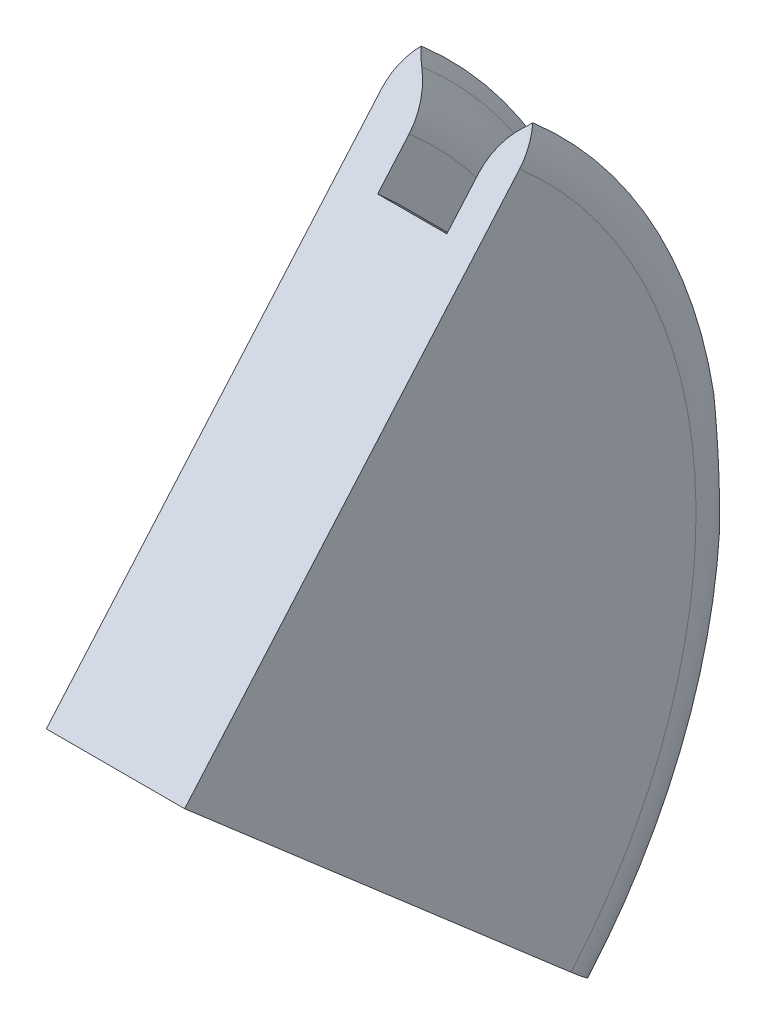
from build123d import *

# Parameters (mm, degrees)
CUT_EXTRUDE1_DEPTH      = 12.33524834
CUT_EXTRUDE1_DEPTH_BACK = 12.33524834
SKETCH3_OUTSIDE_W       = 22.502
SKETCH3_OUTSIDE_H       = 22.502


with BuildPart() as part:
    # Sketch2 → Revolve1 (revolve)
    with BuildSketch(Plane(origin=(0, 0, 0), x_dir=(1, 0, 0), z_dir=(0, 1, 0)), mode=Mode.PRIVATE) as revolve1_sk:
        with BuildLine():
            Line((-1, 0), (1, 0))
            Line((1, 0), (1, 5.5))
            Line((1, 5.5), (1, 7.395254938))
            ThreePointArc((1, 7.395254938), (0.968908672, 7.642673583), (0.877568029, 7.874707079))
            add(Edge.make_bspline(
                [(0.820511391, 7.803982399), (0.850646042, 7.838050546), (0.877568029, 7.874707079)],
                knots=[2.4177114, 2.4177114, 2.4177114, 2.508439234, 2.508439234, 2.508439234], degree=2, weights=[1, 0.998971234, 1]))
            ThreePointArc((0.820511391, 7.803982399), (0.634382255, 7.495682579), (0.569535838, 7.14144004))
            Line((0.569535838, 7.14144004), (0.569535838, 6.447627469))
            Line((0.569535838, 6.447627469), (-0.430464162, 6.447627469))
            Line((-0.430464162, 6.447627469), (-0.430464162, 7.14144004))
            ThreePointArc((-0.430464162, 7.14144004), (-0.495310579, 7.495682579), (-0.681439715, 7.803982399))
            add(Edge.make_bspline(
                [(-0.80833384, 7.983979325), (-0.754845236, 7.886969591), (-0.681439715, 7.803982399)],
                knots=[0.503618874, 0.503618874, 0.503618874, 0.723881254, 0.723881254, 0.723881254], degree=2, weights=[1, 0.993941688, 1]))
            ThreePointArc((-0.80833384, 7.983979325), (-0.950876921, 7.704824123), (-1, 7.395254938))
            Line((-1, 7.395254938), (-1, 5.5))
            Line((-1, 5.5), (-1, 0))
        make_face()
    revolve(revolve1_sk.sketch.rotate(Axis((0, 0, 0), (1, 0, 0)), 180), axis=Axis((0, 0, 0), (1, 0, 0)))

    # Sketch3 outside → Cut-Extrude1 (cut, two sides: drawn at the far end of the back side and taken through both)
    with BuildSketch(Plane(origin=(0, 0, 0), x_dir=(0, 0, -1), z_dir=(1, 0, 0)).offset(-CUT_EXTRUDE1_DEPTH_BACK)):
        Rectangle(SKETCH3_OUTSIDE_W, SKETCH3_OUTSIDE_H)
        Polygon((0, 0), (7.412882699, 8.555619308), (8.184858407, -7.091642708), align=None, mode=Mode.SUBTRACT)
    extrude(amount=CUT_EXTRUDE1_DEPTH + CUT_EXTRUDE1_DEPTH_BACK, mode=Mode.SUBTRACT)


solid = part.part
